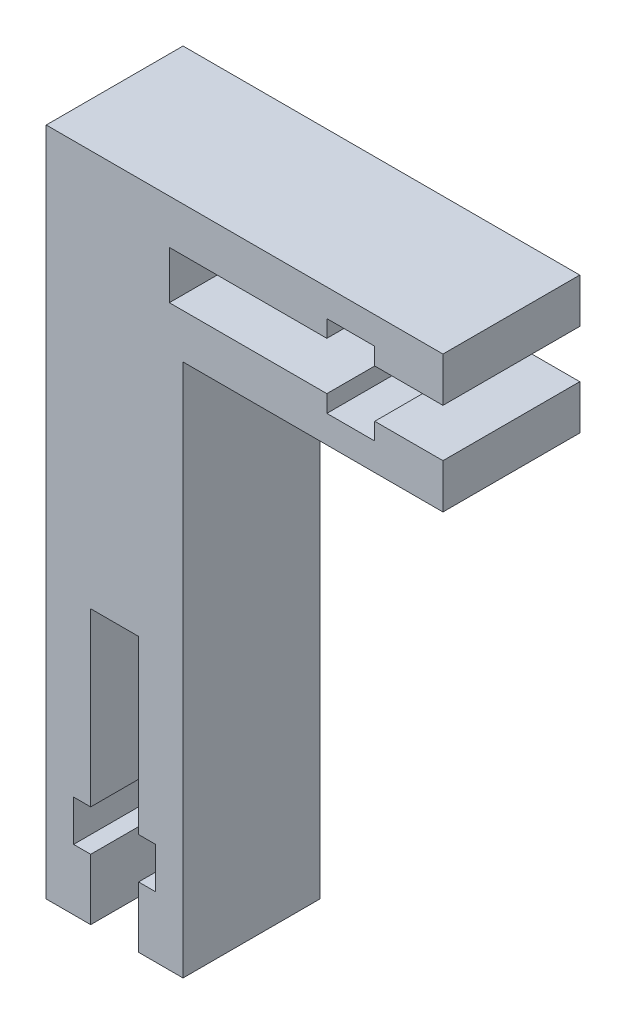
from build123d import *

# Parameters (mm, degrees)
BOSS_EXTRU_1_DEPTH = 10


with BuildPart() as part:
    # Esquisse1 → Boss.-Extru.1 (new body)
    with BuildSketch(Plane.XY):
        Polygon((0, 0), (3.25, 0), (3.25, 4.456409207), (2, 4.456409207), (2, 7.456409207), (3.25, 7.456409207), (3.25, 20), (6.75, 20), (6.75, 7.456409207), (8, 7.456409207), (8, 4.456409207), (6.75, 4.456409207), (6.75, 0), (10, 0), (10, 39), (29, 39), (29, 42.25), (24.012987871, 42.25), (24.012987871, 41), (20.512987871, 41), (20.512987871, 42.25), (9, 42.25), (9, 45.75), (20.512987871, 45.75), (20.512987871, 47), (24.012987871, 47), (24.012987871, 45.75), (29, 45.75), (29, 49), (0, 49), align=None)
    extrude(amount=BOSS_EXTRU_1_DEPTH)


solid = part.part
